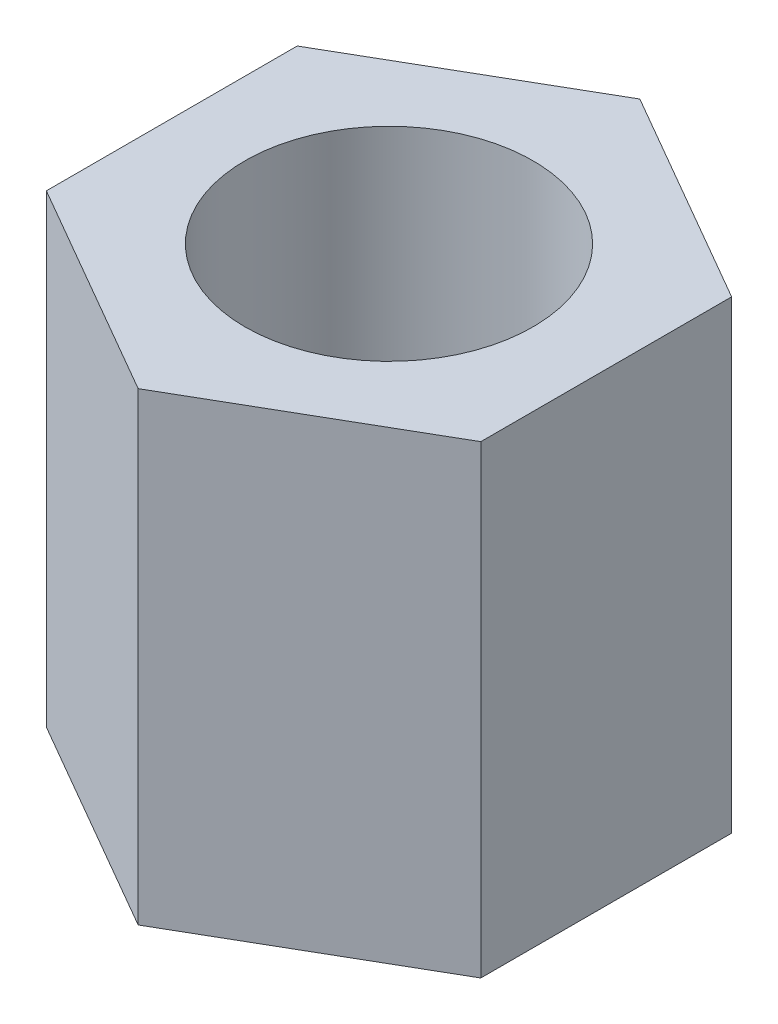
from build123d import *

# Parameters (mm, degrees)
SKETCH_1_R      = 1.55
EXTRUDE_1_DEPTH = 5


with BuildPart() as part:
    # 草图1 → 凸台-拉伸1 (new body)
    with BuildSketch(Plane(origin=(0, 0, 0), x_dir=(1, 0, 0), z_dir=(0, 1, 0))):
        Polygon((0, 2.7), (-2.33826859, 1.35), (-2.33826859, -1.35), (0, -2.7), (2.33826859, -1.35), (2.33826859, 1.35), align=None)
        with Locations(Location((0, 0, 0), (0, 0, 270))):
            Circle(SKETCH_1_R, mode=Mode.SUBTRACT)
    extrude(amount=EXTRUDE_1_DEPTH)


solid = part.part
